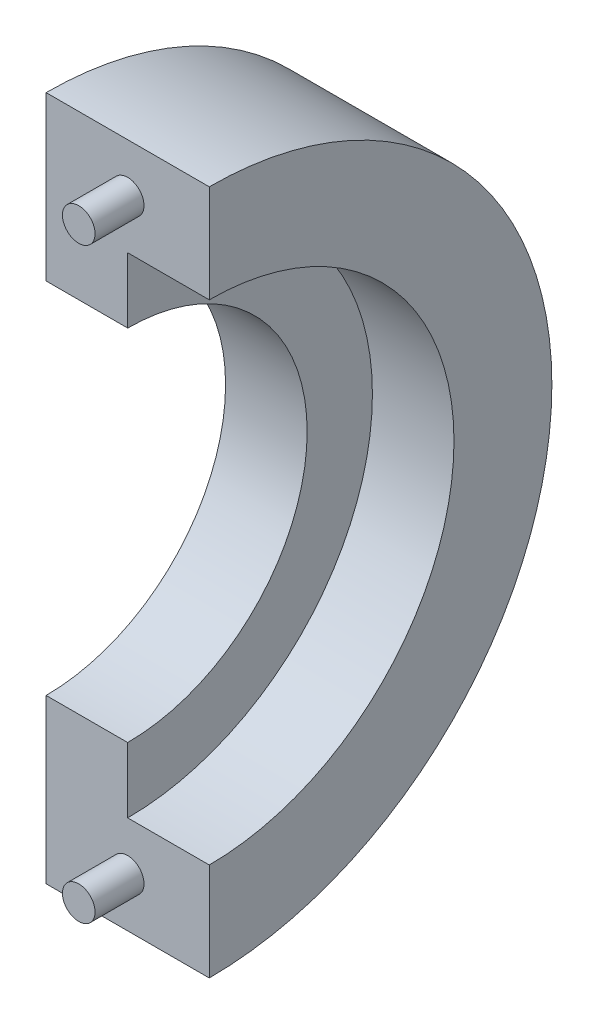
from build123d import *

# Parameters (mm, degrees)
REVOLVE1_ANGLE      = 180
SKETCH2_R           = 0.5
BOSS_EXTRUDE1_DEPTH = 1.5


with BuildPart() as part:
    # Sketch1 → Revolve1 (revolve)
    with BuildSketch(Plane.XY):
        Polygon((-2.5, 5.5), (-5, 5.5), (-5, 10.5), (0, 10.5), (0, 7.5), (-2.5, 7.5), align=None)
    revolve(axis=Axis((0, 0, 0), (-1, 0, 0)), revolution_arc=REVOLVE1_ANGLE)

    # Sketch2 → Boss-Extrude1 (add)
    with BuildSketch(Plane.XY):
        with Locations((-2.5, 9)):
            Circle(SKETCH2_R)
    boss_extrude1 = extrude(amount=BOSS_EXTRUDE1_DEPTH)

    # Mirror1: Boss-Extrude1 across plane
    add(boss_extrude1.mirror(Plane.ZX))


solid = part.part
